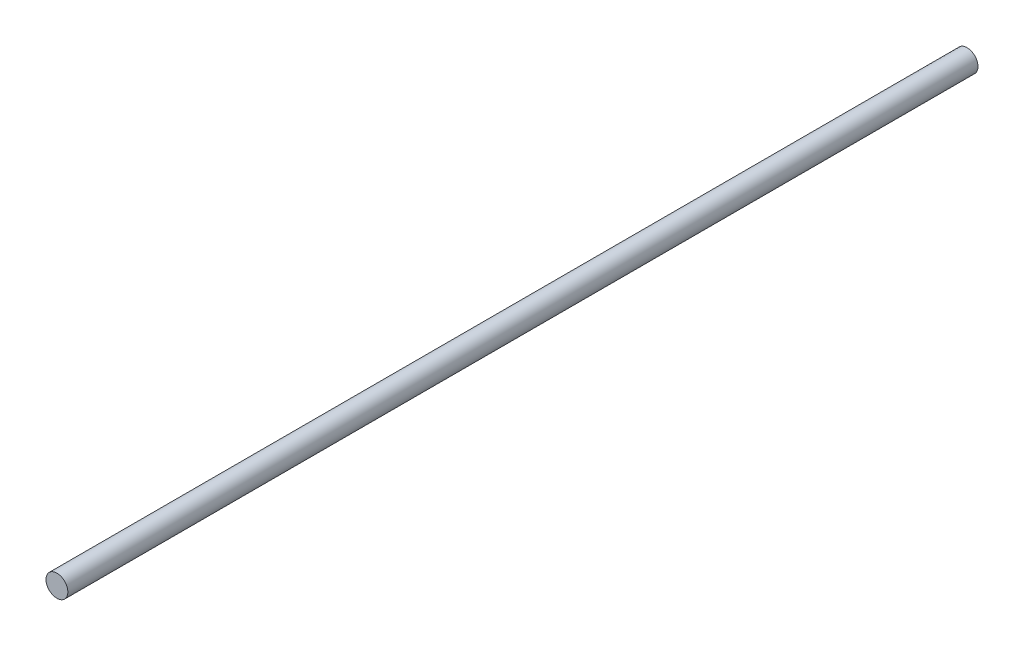
from build123d import *

# Parameters (mm, degrees)
SKETCH_1_R      = 6
EXTRUDE_1_DEPTH = 500


with BuildPart() as part:
    # Эскиз1 → Бобышка-Вытянуть1 (new body)
    with BuildSketch(Plane.XY):
        Circle(SKETCH_1_R)
    extrude(amount=EXTRUDE_1_DEPTH)


solid = part.part
